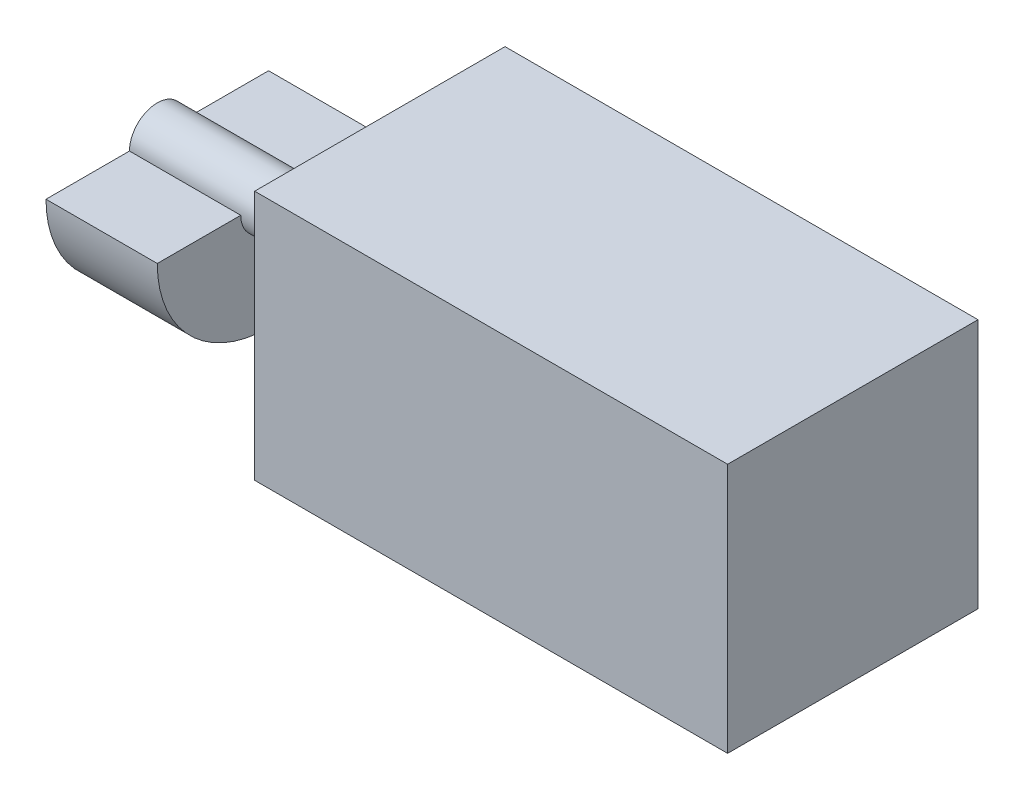
from build123d import *
from build123d.topology import SkipClean

# Parameters (mm, degrees)
SKETCH1_W           = 8.5
SKETCH1_H           = 4.5
BOSS_EXTRUDE1_DEPTH = 4.5
SKETCH2_R           = 1.25
BOSS_EXTRUDE2_DEPTH = 1
SKETCH3_R           = 0.5
BOSS_EXTRUDE3_DEPTH = 1
SKETCH4_R           = 2
BOSS_EXTRUDE4_DEPTH = 2
CUT_EXTRUDE1_START  = -2
CUT_EXTRUDE1_DEPTH  = 2


with BuildPart() as part:
    # Sketch1 → Boss-Extrude1 (new body)
    with BuildSketch(Plane(origin=(0, 0, 0), x_dir=(1, 0, 0), z_dir=(0, 1, 0))):
        Rectangle(SKETCH1_W, SKETCH1_H)
    extrude(amount=BOSS_EXTRUDE1_DEPTH)

    # Sketch2 → Boss-Extrude2 (add)
    with BuildSketch(Plane.ZY.offset(4.25)):
        with Locations((0, 2.25)):
            Circle(SKETCH2_R)
    extrude(amount=BOSS_EXTRUDE2_DEPTH)

    # Sketch3 → Boss-Extrude3 (add)
    with BuildSketch(Plane.ZY.offset(5.25)):
        with Locations((0, 2.25)):
            Circle(SKETCH3_R)
    extrude(amount=BOSS_EXTRUDE3_DEPTH)

    # Sketch4 → Boss-Extrude4 (add)
    with BuildSketch(Plane.ZY.offset(6.25)):
        with Locations((0, 2.25)):
            Circle(SKETCH4_R)
    extrude(amount=BOSS_EXTRUDE4_DEPTH)

    # Sketch5 → Cut-Extrude1 (cut)
    with SkipClean():  # the faces are left unmerged after this step: merging them gives an invalid solid
        with BuildSketch(Plane.ZY.offset(8.25).offset(CUT_EXTRUDE1_START)):
            with BuildLine():
                ThreePointArc((2, 2.25), (0, 4.25), (-2, 2.25))
                Line((-2, 2.25), (-0.5, 2.25))
                ThreePointArc((-0.5, 2.25), (0, 2.75), (0.5, 2.25))
                Line((0.5, 2.25), (2, 2.25))
            make_face()
        extrude(amount=CUT_EXTRUDE1_DEPTH, mode=Mode.SUBTRACT)


solid = part.part
